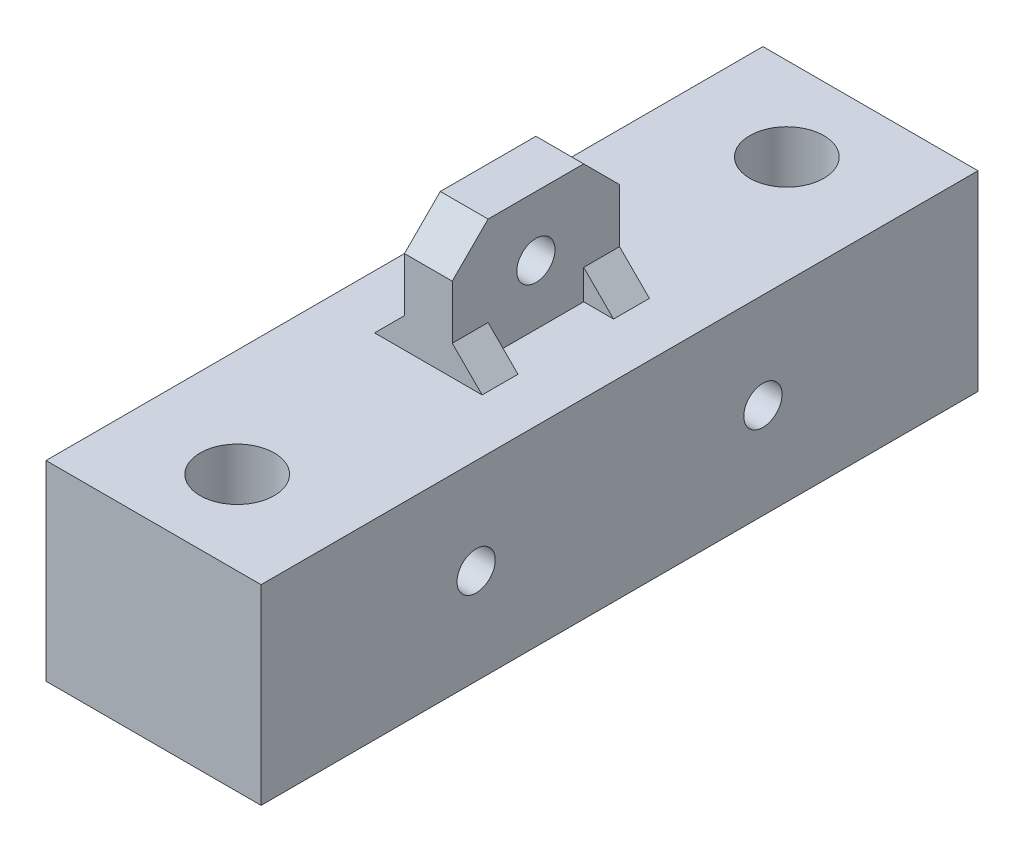
from build123d import *

# Parameters (mm, degrees)
SKETCH1_W           = 18
SKETCH1_H           = 60
BOSS_EXTRUDE1_DEPTH = 16
SKETCH2_R           = 3.1
CUT_EXTRUDE1_DEPTH  = 36.17101079
SKETCH3_R           = 1.6
CUT_EXTRUDE2_DEPTH  = 39.470768123
SKETCH4_W           = 4
SKETCH4_H           = 14
BOSS_EXTRUDE2_DEPTH = 10
SKETCH5_R           = 1.6
CUT_EXTRUDE3_DEPTH  = 42.194659848
CHAMFER1_SIZE       = 3
BOSS_EXTRUDE3_DEPTH = 3
BOSS_EXTRUDE4_DEPTH = 3


with BuildPart() as part:
    # Sketch1 → Boss-Extrude1 (new body)
    with BuildSketch(Plane(origin=(0, 0, 0), x_dir=(1, 0, 0), z_dir=(0, 1, 0))):
        Rectangle(SKETCH1_W, SKETCH1_H)
    extrude(amount=BOSS_EXTRUDE1_DEPTH)

    # Sketch2 → Cut-Extrude1 (cut, through all)
    with BuildSketch(Plane(origin=(0, 16, 0), x_dir=(1, 0, 0), z_dir=(0, 1, 0))):
        with Locations(Location((0, 23, 0), (0, 0, 270))):
            Circle(SKETCH2_R)
        with Locations(Location((0, -23, 0), (0, 0, 270))):
            Circle(SKETCH2_R)
    extrude(amount=-CUT_EXTRUDE1_DEPTH, mode=Mode.SUBTRACT)

    # Sketch3 → Cut-Extrude2 (cut, through all)
    with BuildSketch(Plane.ZY.offset(9)):
        with Locations((-12, 8)):
            Circle(SKETCH3_R)
        with Locations((12, 8)):
            Circle(SKETCH3_R)
    extrude(amount=-CUT_EXTRUDE2_DEPTH, mode=Mode.SUBTRACT)

    # Sketch4 → Boss-Extrude2 (add)
    with BuildSketch(Plane(origin=(0, 16, 0), x_dir=(1, 0, 0), z_dir=(0, 1, 0))):
        Rectangle(SKETCH4_W, SKETCH4_H)
    extrude(amount=BOSS_EXTRUDE2_DEPTH)

    # Sketch5 → Cut-Extrude3 (cut, through all)
    with BuildSketch(Plane.ZY.offset(2)):
        with Locations((0, 21)):
            Circle(SKETCH5_R)
    extrude(amount=-CUT_EXTRUDE3_DEPTH, mode=Mode.SUBTRACT)

    # Chamfer1
    chamfer1_edges = [part.edges().sort_by_distance(p)[0] for p in [
        (0, 26, -7),
        (0, 26, 7),
    ]]
    chamfer(chamfer1_edges, length=CHAMFER1_SIZE)

    # Sketch6 → Boss-Extrude3 (add)
    with BuildSketch(Plane.XY.offset(7)):
        Polygon((-2, 18.5), (-4.5, 16), (-2, 16), align=None)
        Polygon((2, 18.5), (4.5, 16), (2, 16), align=None)
    extrude(amount=-BOSS_EXTRUDE3_DEPTH)

    # Sketch7 → Boss-Extrude4 (add)
    with BuildSketch(Plane(origin=(0, 0, -7), x_dir=(-1, 0, 0), z_dir=(0, 0, -1))):
        Polygon((2, 18.5), (2, 16), (4.5, 16), align=None)
        Polygon((-2, 16), (-2, 18.5), (-4.5, 16), align=None)
    extrude(amount=-BOSS_EXTRUDE4_DEPTH)


solid = part.part
